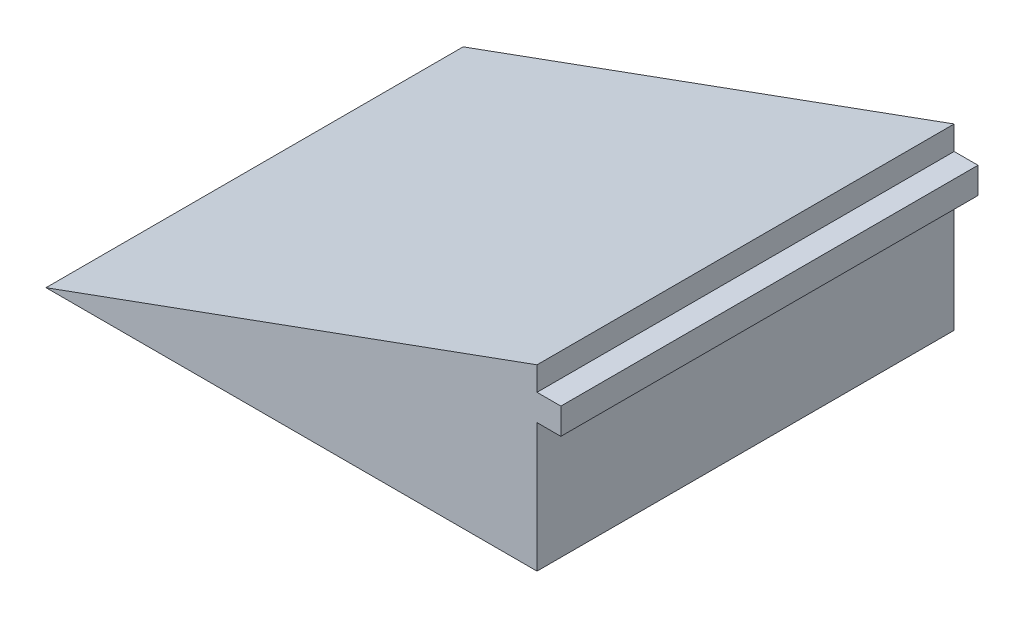
from build123d import *

# Parameters (mm, degrees)
BOSS_EXTRUDE1_DEPTH = 350
SKETCH2_W           = 350
SKETCH2_H           = 22
BOSS_EXTRUDE2_DEPTH = 20


with BuildPart() as part:
    # Sketch1 → Boss-Extrude1 (new body)
    with BuildSketch(Plane.XY):
        Polygon((0, 0), (412, 0), (412, 149.9557), align=None)
    extrude(amount=BOSS_EXTRUDE1_DEPTH)

    # Sketch2 → Boss-Extrude2 (add)
    with BuildSketch(Plane(origin=(412, 0, 0), x_dir=(0, 0, -1), z_dir=(1, 0, 0))):
        with Locations((-175, 118.9557)):
            Rectangle(SKETCH2_W, SKETCH2_H)
    extrude(amount=BOSS_EXTRUDE2_DEPTH)


solid = part.part
